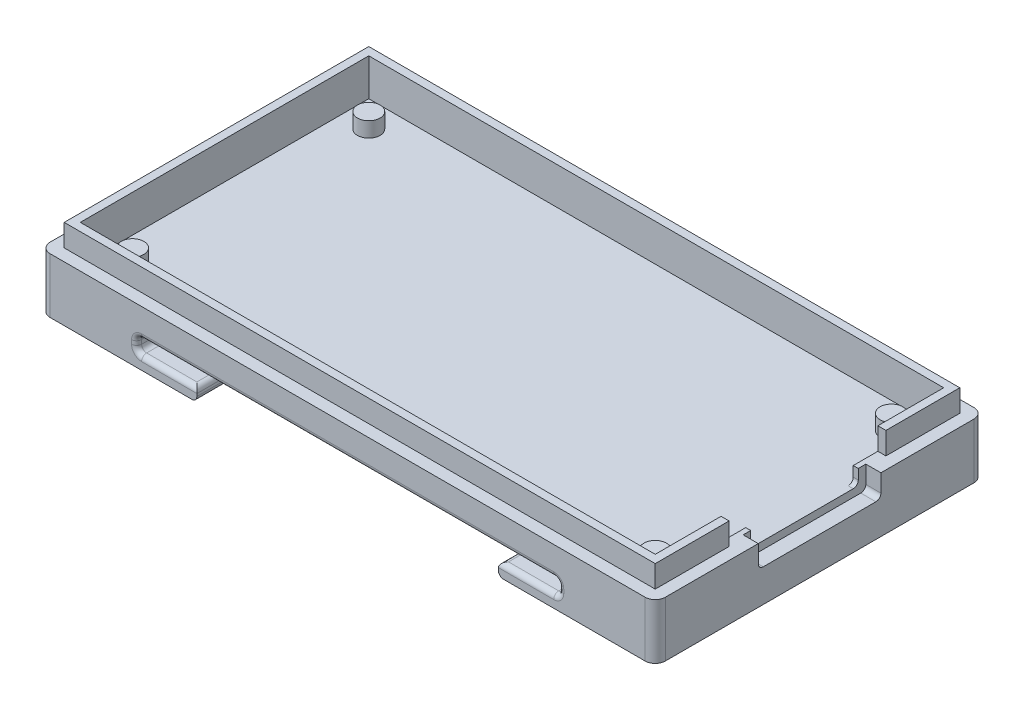
from build123d import *

# Parameters (mm, degrees)
SKETCH2_W               = 61.2
SKETCH2_H               = 32.7
BOSS_EXTRUDE1_DEPTH     = 1.5
BOSS_EXTRUDE2_START     = 1.5
SKETCH2_3_R             = 1.125
BOSS_EXTRUDE2_DEPTH     = 1.5
SKETCH2_4_W             = 61.2
SKETCH2_4_H             = 32.7
BOSS_EXTRUDE3_DEPTH     = 2.5
FILLET1_R               = 1
CUT_EXTRUDE1_DEPTH      = 35.823591142
CUT_EXTRUDE1_DEPTH_BACK = 35.823591142
SKETCH3_W               = 42
SKETCH3_H               = 1.4
SKETCH3_W_2             = 20
SKETCH3_H_2             = 1.25
CUT_EXTRUDE3_DEPTH      = 35.823591142
CUT_EXTRUDE3_DEPTH_BACK = 35.823591142
SKETCH3_4_W             = 5
SKETCH3_4_H             = 1.25
SKETCH3_4_W_2           = 20
FILLET2_R               = 0.5
CUT_EXTRUDE2_START      = 0.75
SKETCH2_5_W             = 1.5
SKETCH2_5_H             = 0.75
SKETCH2_5_H_2           = 10.7
CUT_EXTRUDE2_DEPTH      = 2.25
FILLET3_R               = 0.5
BOSS_EXTRUDE4_DEPTH     = 2.2


with BuildPart() as part:
    # Sketch2 → Boss-Extrude1 (new body)
    with BuildSketch(Plane(origin=(0, 0, 0), x_dir=(1, 0, 0), z_dir=(0, 1, 0))):
        Rectangle(SKETCH2_W, SKETCH2_H)
    extrude(amount=BOSS_EXTRUDE1_DEPTH)

    # Sketch2<3> → Boss-Extrude2 (add)
    with BuildSketch(Plane(origin=(0, 0, 0), x_dir=(1, 0, 0), z_dir=(0, 1, 0)).offset(BOSS_EXTRUDE2_START)):
        Polygon((-30.6, 16.35), (-30.6, -16.35), (30.6, -16.35), (30.6, -6.1), (29.1, -6.1), (29.1, -5.35), (28.6, -5.35), (28.6, -14.35), (-28.6, -14.35), (-28.6, 14.35), (28.6, 14.35), (28.6, 5.35), (30.6, 5.35), (30.6, 16.35), align=None)
        with Locations(Location((-26, 11.75, 0), (0, 0, 270))):
            Circle(SKETCH2_3_R)
        with Locations(Location((-26, -11.75, 0), (0, 0, 270))):
            Circle(SKETCH2_3_R)
        with Locations(Location((26, -11.75, 0), (0, 0, 270))):
            Circle(SKETCH2_3_R)
        with Locations(Location((26, 11.75, 0), (0, 0, 270))):
            Circle(SKETCH2_3_R)
    extrude(amount=BOSS_EXTRUDE2_DEPTH)

    # Sketch2<4> → Boss-Extrude3 (add)
    with BuildSketch(Plane(origin=(0, 0, 0), x_dir=(1, 0, 0), z_dir=(0, 1, 0))):
        Rectangle(SKETCH2_4_W, SKETCH2_4_H)
    extrude(amount=-BOSS_EXTRUDE3_DEPTH)

    # Fillet1
    fillet1_edges = [part.edges().sort_by_distance(p)[0] for p in [
        (-30.6, 0.25, -16.35),
        (30.6, 0.25, -16.35),
        (30.6, 0.25, 16.35),
        (-30.6, 0.25, 16.35),
    ]]
    fillet(fillet1_edges, radius=FILLET1_R)

    # Sketch3 → Cut-Extrude1 (cut, two sides: drawn at the far end of the back side and taken through both)
    with BuildSketch(Plane.XY.offset(-CUT_EXTRUDE1_DEPTH_BACK)):
        with Locations((0, -0.55)):
            Rectangle(SKETCH3_W, SKETCH3_H)
        with Locations((0, -1.875)):
            Rectangle(SKETCH3_W_2, SKETCH3_H_2)
    extrude(amount=CUT_EXTRUDE1_DEPTH + CUT_EXTRUDE1_DEPTH_BACK, mode=Mode.SUBTRACT)

    # Sketch3<4> → Cut-Extrude3 (cut, two sides: drawn at the far end of the back side and taken through both)
    with BuildSketch(Plane.XY.offset(-CUT_EXTRUDE3_DEPTH_BACK)):
        with Locations((12.5, -1.875)):
            Rectangle(SKETCH3_4_W, SKETCH3_4_H)
        with Locations((0, -1.875)):
            Rectangle(SKETCH3_4_W_2, SKETCH3_4_H)
        with Locations((-12.5, -1.875)):
            Rectangle(SKETCH3_4_W, SKETCH3_4_H)
    extrude(amount=CUT_EXTRUDE3_DEPTH + CUT_EXTRUDE3_DEPTH_BACK, mode=Mode.SUBTRACT)

    # Fillet2
    fillet2_edges = [part.edges().sort_by_distance(p)[0] for p in [
        (-18, -1.25, -16.35),
        (-21, -1.25, 0),
        (-21, -0.55, 16.35),
        (-21, 0.15, 0),
        (0, 0.15, 16.35),
        (21, 0.15, 0),
        (21, -0.55, -16.35),
        (21, -1.25, 0),
        (-21, -0.55, -16.35),
        (0, 0.15, -16.35),
        (-18, -1.25, 16.35),
        (21, -0.55, 16.35),
        (18, -1.25, -16.35),
        (18, -1.25, 16.35),
        (-15, -1.25, 0),
        (15, -2.5, 0),
        (-15, -2.5, 0),
        (15, -1.25, 0),
    ]]
    fillet(fillet2_edges, radius=FILLET2_R)

    # Sketch2<5> → Cut-Extrude2 (cut)
    with BuildSketch(Plane(origin=(0, 0, 0), x_dir=(1, 0, 0), z_dir=(0, 1, 0)).offset(CUT_EXTRUDE2_START)):
        with Locations((29.85, 5.725)):
            Rectangle(SKETCH2_5_W, SKETCH2_5_H)
        with Locations((29.85, 0)):
            Rectangle(SKETCH2_5_W, SKETCH2_5_H_2)
        with Locations((29.85, -5.725)):
            Rectangle(SKETCH2_5_W, SKETCH2_5_H)
    extrude(amount=CUT_EXTRUDE2_DEPTH, mode=Mode.SUBTRACT)

    # Fillet3
    fillet3_edges = [part.edges().sort_by_distance(p)[0] for p in [
        (29.85, 0.75, 6.1),
        (29.85, 0.75, -6.1),
        (28.85, 1.5, -5.35),
        (28.85, 1.5, 5.35),
    ]]
    fillet(fillet3_edges, radius=FILLET3_R)

    # Sketch4 → Boss-Extrude4 (add)
    with BuildSketch(Plane(origin=(0, 3, 0), x_dir=(1, 0, 0), z_dir=(0, 1, 0))):
        Polygon((29.4, 15.15), (-29.4, 15.15), (-29.4, -15.15), (29.4, -15.15), (29.4, -7.8), (28.6, -7.8), (28.6, -14.35), (-28.6, -14.35), (-28.6, 14.35), (28.6, 14.35), (28.6, 7.8), (29.4, 7.8), align=None)
    extrude(amount=BOSS_EXTRUDE4_DEPTH)


solid = part.part
